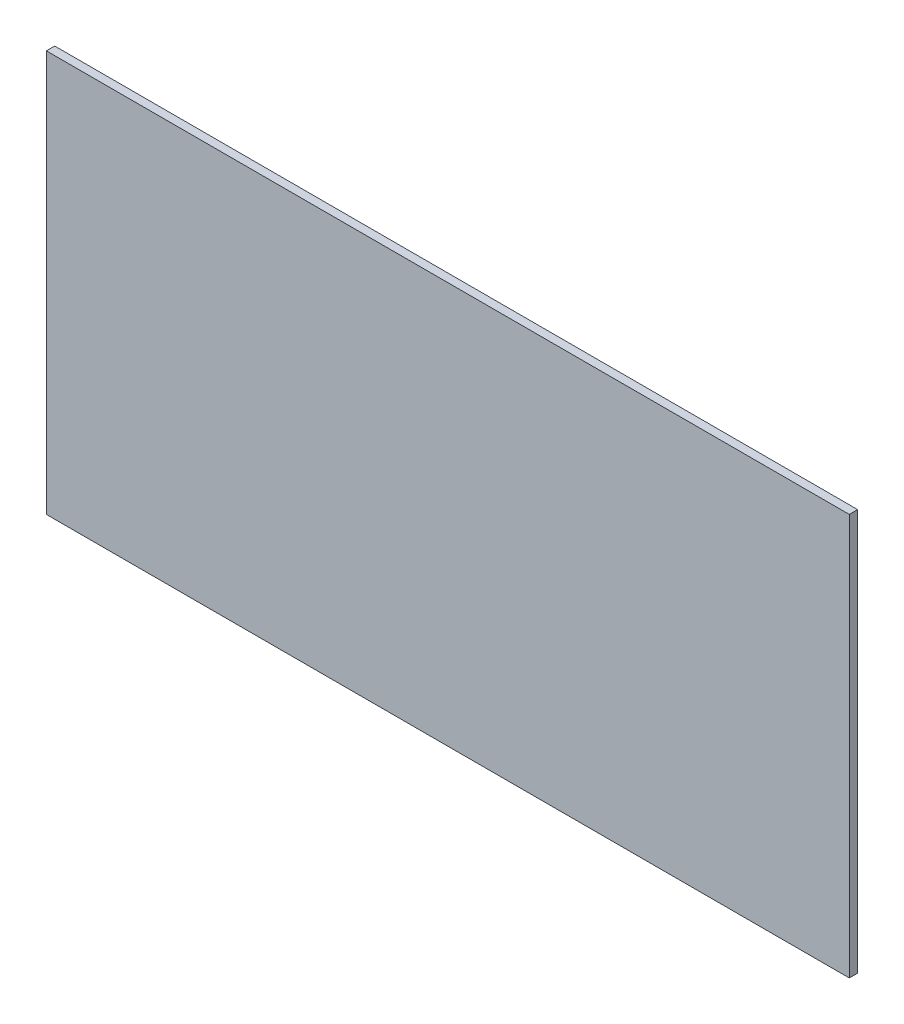
from build123d import *

# Parameters (mm, degrees)
SKETCH1_W           = 1828.8
SKETCH1_H           = 914.4
BOSS_EXTRUDE1_DEPTH = 19.05


with BuildPart() as part:
    # Sketch1 → Boss-Extrude1 (new body)
    with BuildSketch(Plane.XY):
        with Locations((914.4, -457.2)):
            Rectangle(SKETCH1_W, SKETCH1_H)
    extrude(amount=BOSS_EXTRUDE1_DEPTH)


solid = part.part
